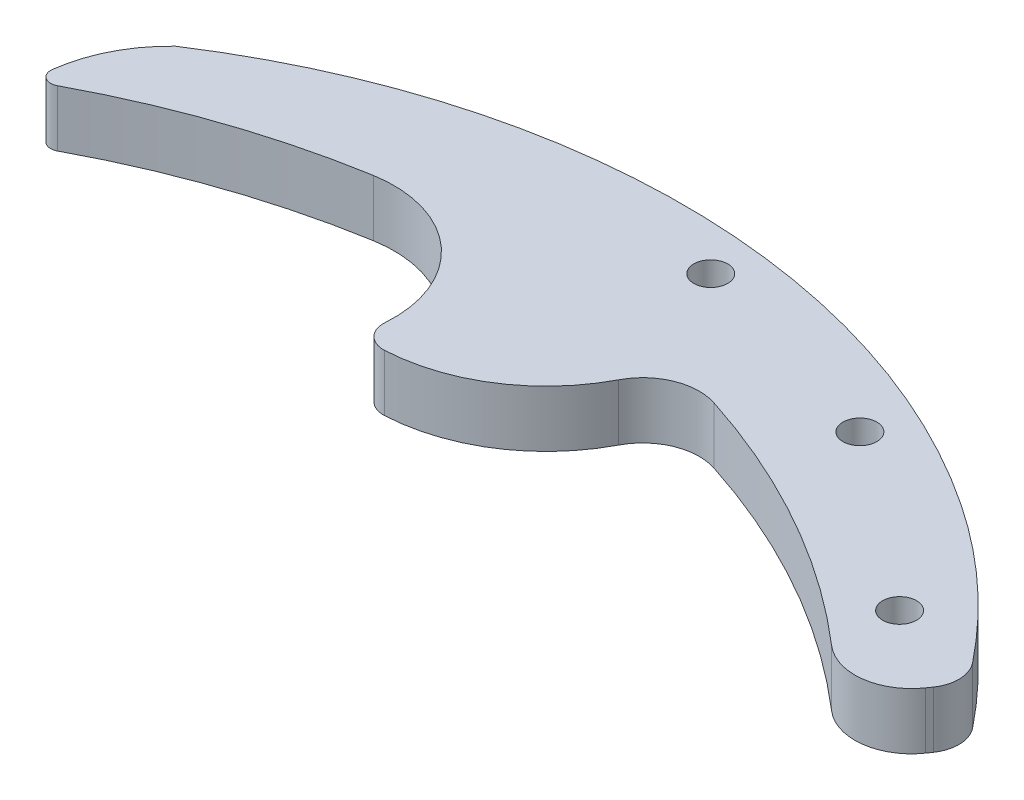
from build123d import *

# Parameters (mm, degrees)
SKETCH_1_R               = 1.5
EXTRUDE_1_DEPTH          = 1.2
EXTRUDE_2_DEPTH          = 10
CUT_EXTRUDE_1_DEPTH      = 93.096371411
CUT_EXTRUDE_1_DEPTH_BACK = 93.096371411
SKETCH_4_R               = 1.5
CUT_EXTRUDE_2_DEPTH      = 5000
SKETCH_5_R               = 1.5
CUT_EXTRUDE_3_DEPTH      = 500
SKETCH_9_R               = 1.5
CUT_EXTRUDE_6_DEPTH      = 500
SKETCH_6_W               = 134.066841626
SKETCH_6_H               = 48.328770964
CUT_EXTRUDE_4_DEPTH      = 1.2
SKETCH_7_W               = 136.291178365
SKETCH_7_H               = 54.597356319
CUT_EXTRUDE_5_DEPTH      = 5
SKETCH_8_R               = 2.504998637
EXTRUDE_3_DEPTH          = 5
CUT_EXTRUDE_START        = -500
CUT_EXTRUDE_7_DEPTH      = 500
CUT_EXTRUDE_8_DEPTH      = 500
CUT_EXTRUDE_9_DEPTH      = 500
FILLET_2_R               = 5
EXTRUDE_4_DEPTH          = 5
FILLET_3_R               = 5
FILLET_4_R               = 2
CUT_EXTRUDE_10_DEPTH     = 50
FILLET_5_R               = 1


with BuildPart() as part:
    # 草图1 → 凸台-拉伸1 (new body)
    with BuildSketch(Plane(origin=(0, 0, 0), x_dir=(1, 0, 0), z_dir=(0, 1, 0))):
        with BuildLine():
            Line((1.554842025, -8.337470752), (-0.430182488, -6.721253648))
            add(Edge.make_bspline(
                [(-12.167013089, 2.582495486), (-11.447119164, 1.921340953), (-10.022984841, 2.808187734), (-8.976354657, 1.809108801), (-8.213499094, 1.403974471), (-8.200391236, 0.349911537), (-8.042555918, -0.493978579), (-7.818959944, -1.429413296), (-6.816890722, -1.753533483), (-5.863601288, -1.34252738), (-4.741281829, -1.710962858), (-4.08275959, -2.621388779), (-3.79245167, -3.751248723), (-3.91045161, -4.869308905), (-3.232112336, -5.62677615), (-2.206661316, -6.030432082), (-1.046114317, -6.062557348), (-0.554897819, -6.564537203), (-0.430182488, -6.721253648)],
                knots=[0, 0, 0, 0, 0.036097754, 0.047992692, 0.058181774, 0.069734768, 0.087708592, 0.096698401, 0.107023851, 0.126400839, 0.138602891, 0.153227265, 0.171393147, 0.187122158, 0.197485969, 0.211171774, 0.233173167, 0.241577569, 0.241577569, 0.241577569, 0.241577569], degree=3))
            add(Edge.make_bspline(
                [(-23.910622578, 9.605703978), (-23.558251314, 9.383041776), (-22.85001025, 7.300114936), (-21.469099437, 8.026620732), (-20.587576459, 8.115237732), (-19.709548371, 8.393102022), (-18.887373608, 8.016971733), (-18.216370279, 7.270572104), (-17.540916668, 6.495384207), (-16.917331111, 5.169819241), (-15.366310155, 5.588705202), (-13.906745135, 5.747852304), (-12.700950999, 4.350101993), (-12.869807319, 3.109436312), (-12.167013089, 2.582495486)],
                knots=[0, 0, 0, 0, 0.161236225, 0.212348344, 0.265446348, 0.336192936, 0.378687986, 0.430636784, 0.526782428, 0.58317029, 0.682556587, 0.781270878, 0.853713789, 1, 1, 1, 1], degree=3))
            add(Edge.make_bspline(
                [(-47.71500508, 10.605110168), (-47.069012481, 9.900665068), (-45.139196949, 9.95795741), (-43.921975491, 11.586374146), (-42.400721003, 11.771016568), (-41.337482007, 11.307681084), (-40.40808197, 10.571392493), (-39.243263098, 10.605948191), (-38.4214004, 11.389817674), (-37.304125392, 11.739033216), (-35.960015429, 12.177678326), (-35.169730239, 11.095889884), (-34.309116257, 10.597574945), (-33.230198284, 10.326758803), (-32.483614479, 11.172498611), (-31.555931442, 11.556931314), (-30.496219104, 11.833170836), (-29.544579211, 11.011421042), (-28.764862011, 9.931048883), (-27.275040054, 9.791587696), (-25.67786866, 9.995507673), (-24.429632089, 10.493743868), (-23.910622578, 9.605703978)],
                knots=[0, 0, 0, 0, 0.101433113, 0.182304189, 0.213922123, 0.268056796, 0.309965909, 0.34593792, 0.389140378, 0.432998877, 0.482664358, 0.529097115, 0.56671955, 0.598853252, 0.644172777, 0.680167064, 0.715860802, 0.759457234, 0.81099574, 0.863337515, 0.916048189, 1, 1, 1, 1], degree=3))
            add(Edge.make_bspline(
                [(-81.542178077, -6.351268144), (-81.044844843, -4.213625321), (-76.423345521, -7.044199198), (-77.193888837, -1.434611804), (-74.499558051, -1.007137962), (-72.119579546, -0.982023336), (-72.013913214, 2.531930358), (-69.193446107, 2.27076818), (-66.979018583, 2.576834428), (-66.793337265, 4.561491582), (-65.228171966, 5.86647802), (-63.704347585, 5.431207109), (-62.480661462, 5.233397848), (-61.483715157, 6.199125284), (-61.300552849, 7.503159562), (-59.783145719, 8.397586745), (-58.519758063, 7.703062295), (-57.095970203, 7.658840879), (-55.836025853, 8.294649296), (-55.32460036, 9.901269354), (-53.585326171, 9.702085323), (-52.400209447, 9.422945796), (-50.584393612, 8.813116301), (-50.168047343, 11.113872633), (-48.335164825, 11.166138113), (-47.71500508, 10.605110168)],
                knots=[0, 0, 0, 0, 0.100331873, 0.186040252, 0.234954161, 0.270300487, 0.337741822, 0.40191981, 0.438279808, 0.476829941, 0.523229195, 0.559516768, 0.58417291, 0.604077361, 0.648703103, 0.670042471, 0.715950186, 0.738312734, 0.768610762, 0.808997733, 0.834826144, 0.87587524, 0.906400305, 0.9417144, 1, 1, 1, 1], degree=3))
            add(Edge.make_bspline(
                [(-4.574887638, 10.66290641), (-7.047776333, 12.318799851), (-11.472376922, 14.618164059), (-18.644622628, 18.44627649), (-25.552826118, 20.285346034), (-32.311147255, 21.765124491), (-38.45622276, 22.334485332), (-46.036730806, 22.337974028), (-53.580560852, 21.321427277), (-60.391912278, 19.259553222), (-67.916492846, 16.400566872), (-77.044091587, 11.490220125), (-84.229889169, 5.096115142), (-88.471829307, 0.104808879), (-88.546333927, -3.099341055), (-86.895953255, -6.534699066), (-83.496346554, -7.409474397), (-81.542178077, -6.351268144)],
                knots=[0.083499365, 0.083499365, 0.083499365, 0.083499365, 0.162308773, 0.214040795, 0.297345888, 0.349154488, 0.396314503, 0.459530434, 0.548645129, 0.595484357, 0.646703325, 0.76081959, 0.864658636, 0.902713076, 0.926128156, 0.944546812, 1, 1, 1, 1], degree=3))
            ThreePointArc((-4.574887638, 10.66290641), (2.168791448, 5.355026647), (8.021297782, -0.921832822))
            ThreePointArc((8.021297782, -0.921832822), (8.67491192, -2.691224286), (8.143227785, -4.500994872))
            Line((8.143227785, -4.500994872), (5.915584874, -7.718701298))
            ThreePointArc((5.915584874, -7.718701298), (3.870472767, -8.981318439), (1.554842025, -8.337470752))
        make_face()
        with Locations(Location((-81.41369729, 0.541251493, 0), (0, 0, 270))):
            Circle(SKETCH_1_R, mode=Mode.SUBTRACT)
        with Locations(Location((0.783039877, -0.136157483, 0), (0, 0, 270))):
            Circle(SKETCH_1_R, mode=Mode.SUBTRACT)
        with Locations(Location((-33.354785226, 17.302208681, 0), (0, 0, 270))):
            Circle(SKETCH_1_R, mode=Mode.SUBTRACT)
    extrude(amount=EXTRUDE_1_DEPTH)

    # 草图2 → 凸台-拉伸2 (add)
    with BuildSketch(Plane(origin=(0, 1.2, 0), x_dir=(1, 0, 0), z_dir=(0, 1, 0))):
        with BuildLine():
            Line((8.143227785, -4.500994872), (5.915584874, -7.718701298))
            ThreePointArc((5.915584874, -7.718701298), (3.870472767, -8.981318439), (1.554842025, -8.337470752))
            ThreePointArc((1.554842025, -8.337470752), (-39.653813959, 6.874149931), (-81.542178077, -6.351268144))
            ThreePointArc((-81.542178077, -6.351268144), (-86.809846383, -6.371610018), (-88.423257633, -1.357066439))
            ThreePointArc((-88.423257633, -1.357066439), (-48.803984412, 20.731416825), (-4.574887638, 10.66290641))
            ThreePointArc((-4.574887638, 10.66290641), (2.168791448, 5.355026647), (8.021297782, -0.921832822))
            ThreePointArc((8.021297782, -0.921832822), (8.67491192, -2.691224286), (8.143227785, -4.500994872))
        make_face()
    extrude(amount=EXTRUDE_2_DEPTH)

    # 草图3 → 切除-拉伸1 (cut, two sides: drawn at the far end of the back side and taken through both)
    with BuildSketch(Plane(origin=(0, 11.2, 0), x_dir=(1, 0, 0), z_dir=(0, 1, 0)).offset(-CUT_EXTRUDE_1_DEPTH_BACK)):
        with BuildLine():
            Line((-87.507027042, -5.743661214), (-106.141269059, 14.985848881))
            Line((-106.141269059, 14.985848881), (-8.241902353, 31.206831816))
            Line((-8.241902353, 31.206831816), (8.962170457, 13.429289912))
            Line((8.962170457, 13.429289912), (8.021297782, -0.921832822))
            ThreePointArc((8.021297782, -0.921832822), (5.215580669, 2.32898401), (2.168791448, 5.355026647))
            ThreePointArc((2.168791448, 5.355026647), (-1.101119594, 8.138467032), (-4.574887638, 10.66290641))
            ThreePointArc((-4.574887638, 10.66290641), (-48.803984412, 20.731416825), (-88.423257633, -1.357066439))
            ThreePointArc((-88.423257633, -1.357066439), (-88.556022202, -3.673781246), (-87.507027042, -5.743661214))
        make_face()
        with BuildLine():
            Line((1.554842025, -8.337470752), (-81.542178077, -6.351268144))
            ThreePointArc((-81.542178077, -6.351268144), (-39.653813959, 6.874149931), (1.554842025, -8.337470752))
        make_face()
    extrude(amount=CUT_EXTRUDE_1_DEPTH + CUT_EXTRUDE_1_DEPTH_BACK, mode=Mode.SUBTRACT)

    # 草图4 → 切除-拉伸2 (cut)
    with BuildSketch(Plane.XZ):
        with Locations(Location((0.783039877, 0.136157483, 0), (0, 0, 270))):
            Circle(SKETCH_4_R)
    extrude(amount=-CUT_EXTRUDE_2_DEPTH, mode=Mode.SUBTRACT)

    # 草图5 → 切除-拉伸3 (cut)
    with BuildSketch(Plane(origin=(0, 0, 0), x_dir=(-1, 0, 0), z_dir=(0, -1, 0))):
        with Locations(Location((33.354785226, 17.302208681, 0), (0, 0, 90))):
            Circle(SKETCH_5_R)
        with Locations((81.41369729, 0.541251493)):
            Circle(SKETCH_5_R)
    extrude(amount=-CUT_EXTRUDE_3_DEPTH, mode=Mode.SUBTRACT)

    # 草图9 → 切除-拉伸6 (cut)
    with BuildSketch(Plane.XZ):
        with Locations(Location((-14.650535253, -11.784407101, 0), (0, 0, 270))):
            Circle(SKETCH_9_R)
    extrude(amount=-CUT_EXTRUDE_6_DEPTH, mode=Mode.SUBTRACT)

    # 草图6 → 切除-拉伸4 (cut)
    with BuildSketch(Plane.XZ):
        with Locations((-44.334364387, -13.713059238)):
            Rectangle(SKETCH_6_W, SKETCH_6_H)
    extrude(amount=-CUT_EXTRUDE_4_DEPTH, mode=Mode.SUBTRACT)

    # 草图7 → 切除-拉伸5 (cut)
    with BuildSketch(Plane.XZ.offset(-1.2)):
        with Locations((-47.064232203, -10.780978991)):
            Rectangle(SKETCH_7_W, SKETCH_7_H)
    extrude(amount=-CUT_EXTRUDE_5_DEPTH, mode=Mode.SUBTRACT)

    # 草图8 → 凸台-拉伸3 (add)
    with BuildSketch(Plane(origin=(0, 11.2, 0), x_dir=(1, 0, 0), z_dir=(0, 1, 0))):
        with Locations((-81.41369729, 0.541251493)):
            Circle(SKETCH_8_R)
    extrude(amount=-EXTRUDE_3_DEPTH)

    # 草图12 → 切除-拉伸7 (cut)
    with BuildSketch(Plane(origin=(0, 11.2, 0), x_dir=(1, 0, 0), z_dir=(0, 1, 0)).offset(CUT_EXTRUDE_START)):
        with BuildLine():
            Line((-58.639801005, 18.510571882), (-112.071356554, 17.290982028))
            Line((-112.071356554, 17.290982028), (-102.035647415, -15.683490858))
            Line((-102.035647415, -15.683490858), (-71.109278434, -17.799864895))
            Line((-71.109278434, -17.799864895), (-72.583441893, -0.763949275))
            ThreePointArc((-72.583441893, -0.763949275), (-77.17168255, -3.38304187), (-81.542178077, -6.351268144))
            ThreePointArc((-81.542178077, -6.351268144), (-84.21561064, -7.222088194), (-86.87883151, -6.320520766))
            ThreePointArc((-86.87883151, -6.320520766), (-88.505413997, -3.431359279), (-87.496633924, -0.272975602))
            ThreePointArc((-87.496633924, -0.272975602), (-74.361355564, 11.10542341), (-58.639801005, 18.510571882))
        make_face()
    extrude(amount=CUT_EXTRUDE_7_DEPTH, mode=Mode.SUBTRACT)

    # 草图13 → 切除-拉伸8 (cut)
    with BuildSketch(Plane(origin=(0, 11.2, 0), x_dir=(1, 0, 0), z_dir=(0, 1, 0))):
        with BuildLine():
            Line((-58.639801005, 18.510571882), (-93.715909783, 19.516276053))
            Line((-93.715909783, 19.516276053), (-99.02615609, -9.026297846))
            Line((-99.02615609, -9.026297846), (-86.075060822, -21.472187628))
            Line((-86.075060822, -21.472187628), (-50.736103736, -15.249242737))
            Line((-50.736103736, -15.249242737), (-34.722392217, -9.026297846))
            Line((-34.722392217, -9.026297846), (-40.736049388, 6.891380001))
            ThreePointArc((-40.736049388, 6.891380001), (-63.801132914, 6.078389209), (-85.188761068, -2.595041141))
            ThreePointArc((-85.188761068, -2.595041141), (-87.346939719, -2.261053128), (-87.32425699, -0.077302094))
            ThreePointArc((-87.32425699, -0.077302094), (-74.252009108, 11.176444211), (-58.639801005, 18.510571882))
        make_face()
    extrude(amount=-CUT_EXTRUDE_8_DEPTH, mode=Mode.SUBTRACT)

    # 草图14 → 切除-拉伸9 (cut)
    with BuildSketch(Plane(origin=(0, 11.2, 0), x_dir=(1, 0, 0), z_dir=(0, 1, 0))):
        with BuildLine():
            Line((-85.188761068, -2.595041141), (9.410288112, -16.335196714))
            Line((9.410288112, -16.335196714), (3.870472767, -8.981318439))
            ThreePointArc((3.870472767, -8.981318439), (-39.477229569, 10.694099657), (-85.188761068, -2.595041141))
        make_face()
    extrude(amount=-CUT_EXTRUDE_9_DEPTH, mode=Mode.SUBTRACT)

    # 圆角2
    fillet_2_edges = [part.edges().sort_by_distance(p)[0] for p in [
        (3.870472767, 8.7, 8.981318439),
    ]]
    fillet(fillet_2_edges, radius=FILLET_2_R)

    # 草图16 → 凸台-拉伸4 (add)
    with BuildSketch(Plane(origin=(0, 11.2, 0), x_dir=(1, 0, 0), z_dir=(0, 1, 0))):
        with BuildLine():
            ThreePointArc((-55.7948874, 9.913169561), (-46.540448411, 6.6587671), (-44.381584205, -2.910719914))
            ThreePointArc((-44.381584205, -2.910719914), (-33.893561356, -0.183849707), (-27.936053363, 8.868362338))
            ThreePointArc((-27.936053363, 8.868362338), (-41.811811004, 10.821544438), (-55.7948874, 9.913169561))
        make_face()
    extrude(amount=-EXTRUDE_4_DEPTH)

    # 圆角3
    fillet_3_edges = [part.edges().sort_by_distance(p)[0] for p in [
        (-27.936053363, 8.7, -8.868362338),
    ]]
    fillet(fillet_3_edges, radius=FILLET_3_R)

    # 圆角4
    fillet_4_edges = [part.edges().sort_by_distance(p)[0] for p in [
        (-44.381584205, 8.7, 2.910719914),
    ]]
    fillet(fillet_4_edges, radius=FILLET_4_R)

    # 草图17 → 切除-拉伸10 (cut)
    with BuildSketch(Plane(origin=(0, 11.2, 0), x_dir=(1, 0, 0), z_dir=(0, 1, 0))):
        with BuildLine():
            Line((-78.188761068, 1.956223286), (-81.129694376, -16.673779651))
            Line((-81.129694376, -16.673779651), (-94.709773696, -4.588158821))
            Line((-94.709773696, -4.588158821), (-97.178879027, 7.17257973))
            Line((-97.178879027, 7.17257973), (-87.324260178, -0.077297303))
            ThreePointArc((-87.324260178, -0.077297303), (-80.335174498, 6.963906587), (-72.245380583, 12.706824424))
            ThreePointArc((-72.245380583, 12.706824424), (-76.68832012, 8.144891799), (-78.188761068, 1.956223286))
        make_face()
    extrude(amount=-CUT_EXTRUDE_10_DEPTH, mode=Mode.SUBTRACT)

    # 圆角5
    fillet_5_edges = [part.edges().sort_by_distance(p)[0] for p in [
        (-78.188761068, 8.7, -1.956223286),
    ]]
    fillet(fillet_5_edges, radius=FILLET_5_R)


solid = part.part
